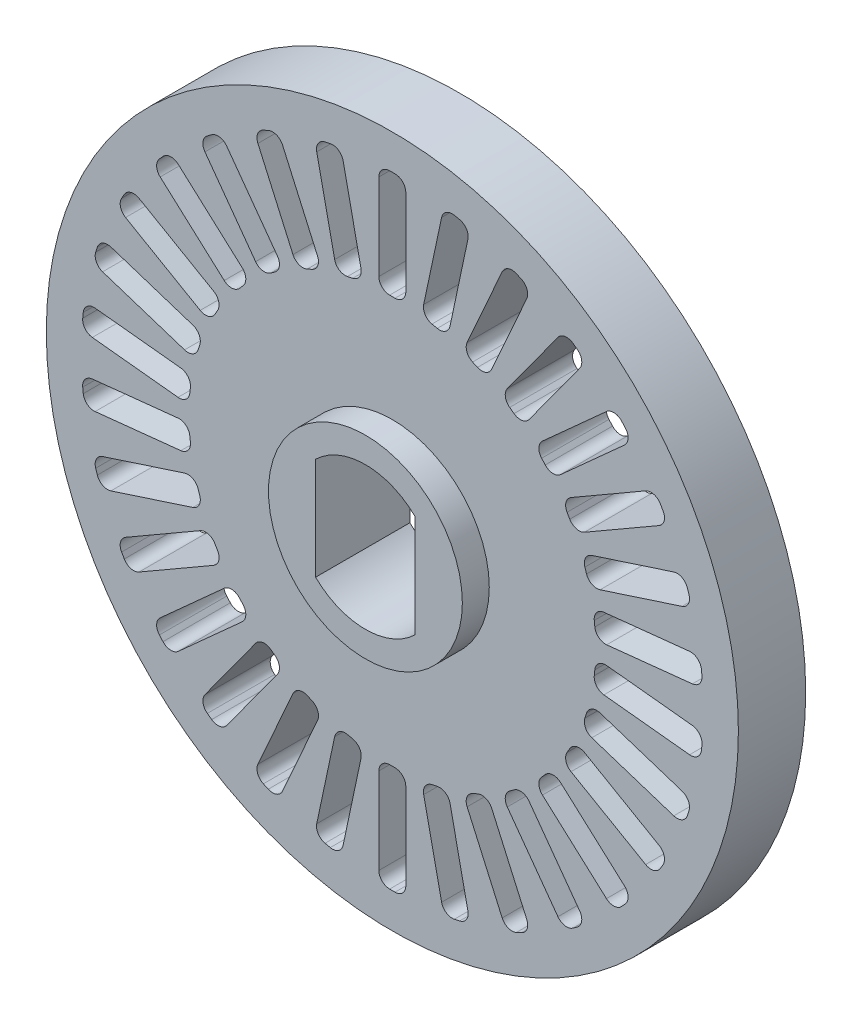
from build123d import *

# Parameters (mm, degrees)
SKIZZE1_R                       = 12.85
AUFSATZ_LINEAR_AUSTRAGEN1_DEPTH = 2.5
SKIZZE2_R                       = 3.6
AUFSATZ_LINEAR_AUSTRAGEN2_DEPTH = 1
SCHNITT_LINEAR_AUSTRAGEN2_DEPTH = 19.506620437
SCHNITT_LINEAR_AUSTRAGEN1_REACH = 20.344
KREISMUSTER1_COUNT              = 30


with BuildPart() as part:
    # Skizze1 → Aufsatz-Linear austragen1 (new body)
    with BuildSketch(Plane.XY):
        Circle(SKIZZE1_R)
    extrude(amount=AUFSATZ_LINEAR_AUSTRAGEN1_DEPTH)

    # Skizze2 → Aufsatz-Linear austragen2 (add)
    with BuildSketch(Plane.XY.offset(2.5)):
        Circle(SKIZZE2_R)
    extrude(amount=AUFSATZ_LINEAR_AUSTRAGEN2_DEPTH)

    # Skizze4 → Schnitt-Linear austragen2 (cut, through all)
    with BuildSketch(Plane.XY.offset(3.5)):
        with BuildLine():
            Line((-1.85, 1.897366596), (-1.85, -1.897366596))
            ThreePointArc((-1.85, -1.897366596), (0, -2.65), (1.85, -1.897366596))
            Line((1.85, -1.897366596), (1.85, 1.897366596))
            ThreePointArc((1.85, 1.897366596), (0, 2.65), (-1.85, 1.897366596))
        make_face()
    extrude(amount=-SCHNITT_LINEAR_AUSTRAGEN2_DEPTH, mode=Mode.SUBTRACT)

    # Skizze3 → Schnitt-Linear austragen1 (cut, up to next)
    with BuildSketch(Plane.XY.offset(2.5), mode=Mode.PRIVATE) as schnitt_linear_austragen1_sk1:
        with BuildLine():
            Line((-0.1, 11.55), (0.1, 11.55))
            ThreePointArc((0.1, 11.55), (0.382842712, 11.432842712), (0.5, 11.15))
            Line((0.5, 11.15), (0.5, 7.95))
            ThreePointArc((0.5, 7.95), (0.382842712, 7.667157288), (0.1, 7.55))
            Line((0.1, 7.55), (-0.1, 7.55))
            ThreePointArc((-0.1, 7.55), (-0.382842712, 7.667157288), (-0.5, 7.95))
            Line((-0.5, 7.95), (-0.5, 11.15))
            ThreePointArc((-0.5, 11.15), (-0.382842712, 11.432842712), (-0.1, 11.55))
        make_face()
    schnitt_linear_austragen1_tool1 = extrude(schnitt_linear_austragen1_sk1.sketch, amount=-SCHNITT_LINEAR_AUSTRAGEN1_REACH, mode=Mode.PRIVATE) & part.part
    schnitt_linear_austragen1 = schnitt_linear_austragen1_tool1.solids().sort_by_distance((0, 9.55, 2.5))[0]
    add(schnitt_linear_austragen1, mode=Mode.SUBTRACT)

    # Kreismuster1: Schnitt-Linear austragen1 ×30 about axis
    kreismuster1_axis = Axis((0, 0, 0), (0, 0, 1))
    for i in range(1, KREISMUSTER1_COUNT):
        add(schnitt_linear_austragen1.rotate(kreismuster1_axis, i * 360 / KREISMUSTER1_COUNT), mode=Mode.SUBTRACT)


solid = part.part
